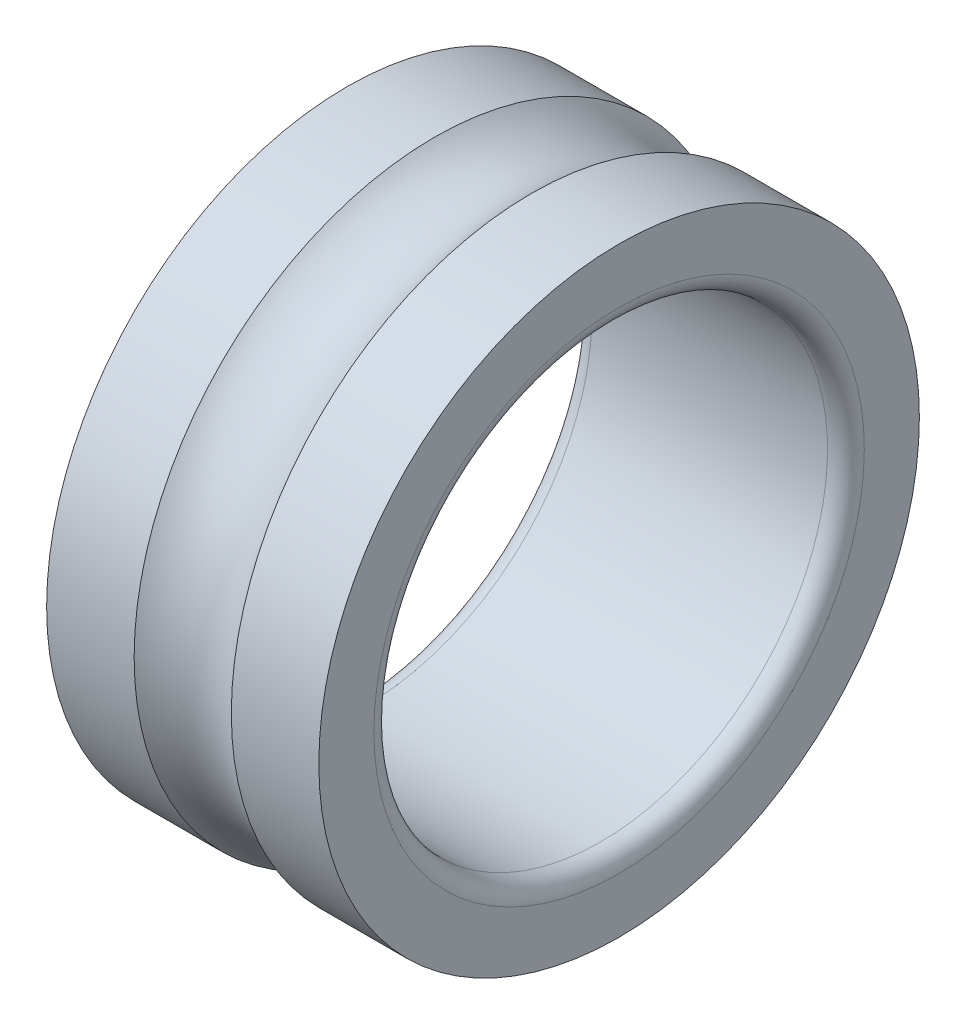
from build123d import *


with BuildPart() as part:
    # Esquisse1 → Base-Révolution (revolve)
    with BuildSketch(Plane.XY):
        with BuildLine():
            Line((-3.892857143, 7.5), (3.892857143, 7.5))
            ThreePointArc((3.892857143, 7.5), (4.322171974, 7.677828026), (4.5, 8.107142857))
            Line((4.5, 8.107142857), (4.5, 9.928571429))
            Line((4.5, 9.928571429), (1.60634901, 9.928571429))
            ThreePointArc((1.60634901, 9.928571429), (0, 9.321428571), (-1.60634901, 9.928571429))
            Line((-1.60634901, 9.928571429), (-4.5, 9.928571429))
            Line((-4.5, 9.928571429), (-4.5, 8.107142857))
            ThreePointArc((-4.5, 8.107142857), (-4.322171974, 7.677828026), (-3.892857143, 7.5))
        make_face()
    revolve(axis=Axis((0, 0, 0), (1, 0, 0)))


solid = part.part
